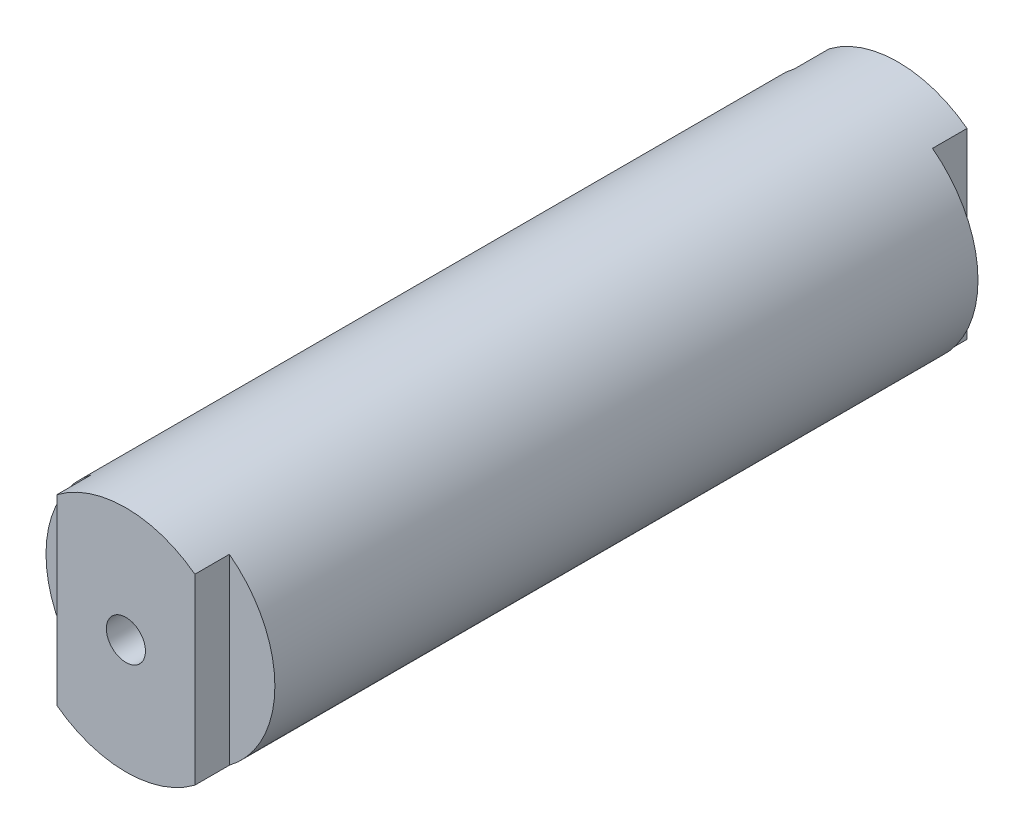
from build123d import *

# Parameters (mm, degrees)
SKETCH1_R           = 26.3525
BOSS_EXTRUDE1_DEPTH = 88.9
CUT_EXTRUDE1_DEPTH  = 7.9502
CUT_EXTRUDE2_START  = -3
SKETCH3_R           = 22.86
CUT_EXTRUDE2_DEPTH  = 155.8996
SKETCH5_R           = 4.5
CUT_EXTRUDE3_DEPTH  = 182.663833804


with BuildPart() as part:
    # Sketch1 → Boss-Extrude1 (new, symmetric)
    with BuildSketch(Plane.XY):
        Circle(SKETCH1_R)
    extrude(amount=BOSS_EXTRUDE1_DEPTH, both=True)

    # Sketch2 → Cut-Extrude1 (cut)
    with BuildSketch(Plane.XY.offset(88.9)):
        with BuildLine():
            Line((-15.875, 21.034225235), (-15.875, -21.034225235))
            ThreePointArc((-15.875, -21.034225235), (-26.3525, 0), (-15.875, 21.034225235))
        make_face()
        with BuildLine():
            Line((15.875, -21.034225235), (15.875, 21.034225235))
            ThreePointArc((15.875, 21.034225235), (26.3525, 0), (15.875, -21.034225235))
        make_face()
    cut_extrude1 = extrude(amount=-CUT_EXTRUDE1_DEPTH, mode=Mode.SUBTRACT)

    # Mirror1: Cut-Extrude1 across plane
    add(cut_extrude1.mirror(Plane.XY), mode=Mode.SUBTRACT)

    # Sketch3 → Cut-Extrude2 (cut)
    with BuildSketch(Plane.XY.offset(80.9498).offset(CUT_EXTRUDE2_START)):
        Circle(SKETCH3_R)
    extrude(amount=-CUT_EXTRUDE2_DEPTH, mode=Mode.SUBTRACT)

    # Sketch5 → Cut-Extrude3 (cut, through all)
    with BuildSketch(Plane.XY.offset(88.9)):
        Circle(SKETCH5_R)
    extrude(amount=-CUT_EXTRUDE3_DEPTH, mode=Mode.SUBTRACT)


solid = part.part
